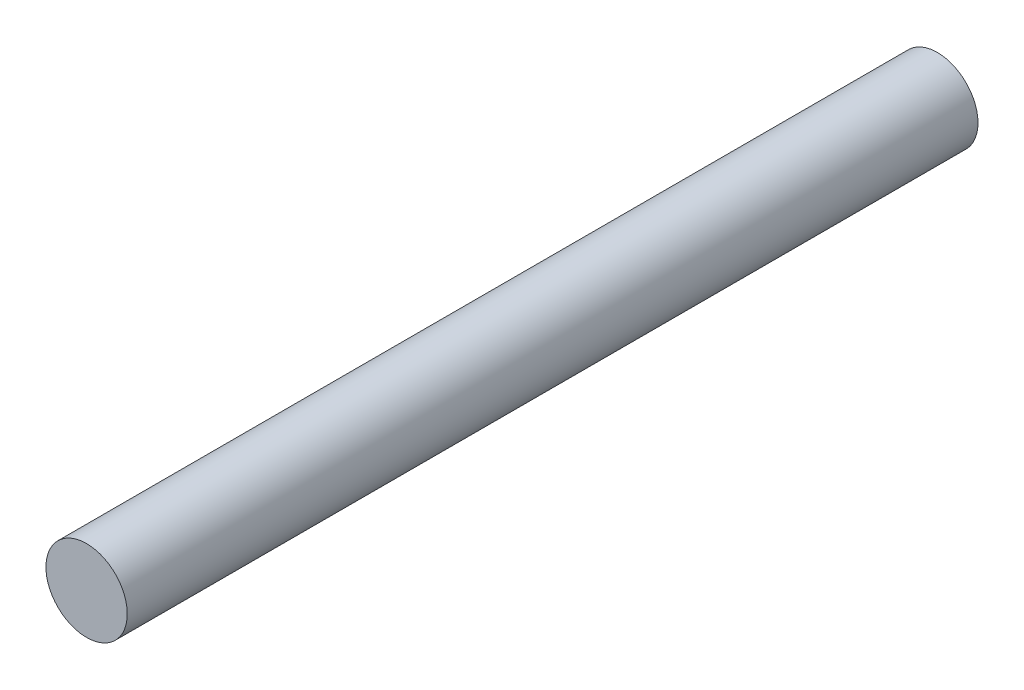
from build123d import *

# Parameters (mm, degrees)
SKETCH1_R           = 2.5
BOSS_EXTRUDE1_DEPTH = 52.3


with BuildPart() as part:
    # Sketch1 → Boss-Extrude1 (new body)
    with BuildSketch(Plane.XY):
        Circle(SKETCH1_R)
    extrude(amount=BOSS_EXTRUDE1_DEPTH)


solid = part.part
